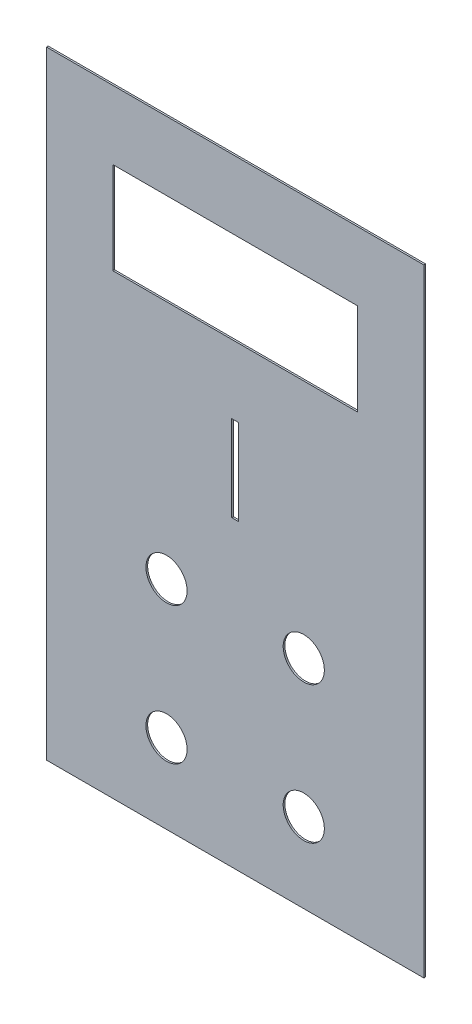
from build123d import *

# Parameters (mm, degrees)
SKETCH1_W           = 110
SKETCH1_H           = 180
BOSS_EXTRUDE1_DEPTH = 0.5
SKETCH2_R           = 6
SKETCH2_W           = 71.3
SKETCH2_H           = 26.8
SKETCH2_W_2         = 2
SKETCH2_H_2         = 25
CUT_EXTRUDE1_DEPTH  = 106.476300656


with BuildPart() as part:
    # Sketch1 → Boss-Extrude1 (new body)
    with BuildSketch(Plane.XY):
        Rectangle(SKETCH1_W, SKETCH1_H)
    extrude(amount=BOSS_EXTRUDE1_DEPTH)

    # Sketch2 → Cut-Extrude1 (cut, through all)
    with BuildSketch(Plane.XY.offset(0.5)):
        with Locations((-20, -26.8)):
            Circle(SKETCH2_R)
        with Locations((20, -26.8)):
            Circle(SKETCH2_R)
        with Locations((20, -66.8)):
            Circle(SKETCH2_R)
        with Locations((-20, -66.8)):
            Circle(SKETCH2_R)
        with Locations((0, 56.6)):
            Rectangle(SKETCH2_W, SKETCH2_H)
        with Locations((0, 10.7)):
            Rectangle(SKETCH2_W_2, SKETCH2_H_2)
    extrude(amount=-CUT_EXTRUDE1_DEPTH, mode=Mode.SUBTRACT)


solid = part.part
